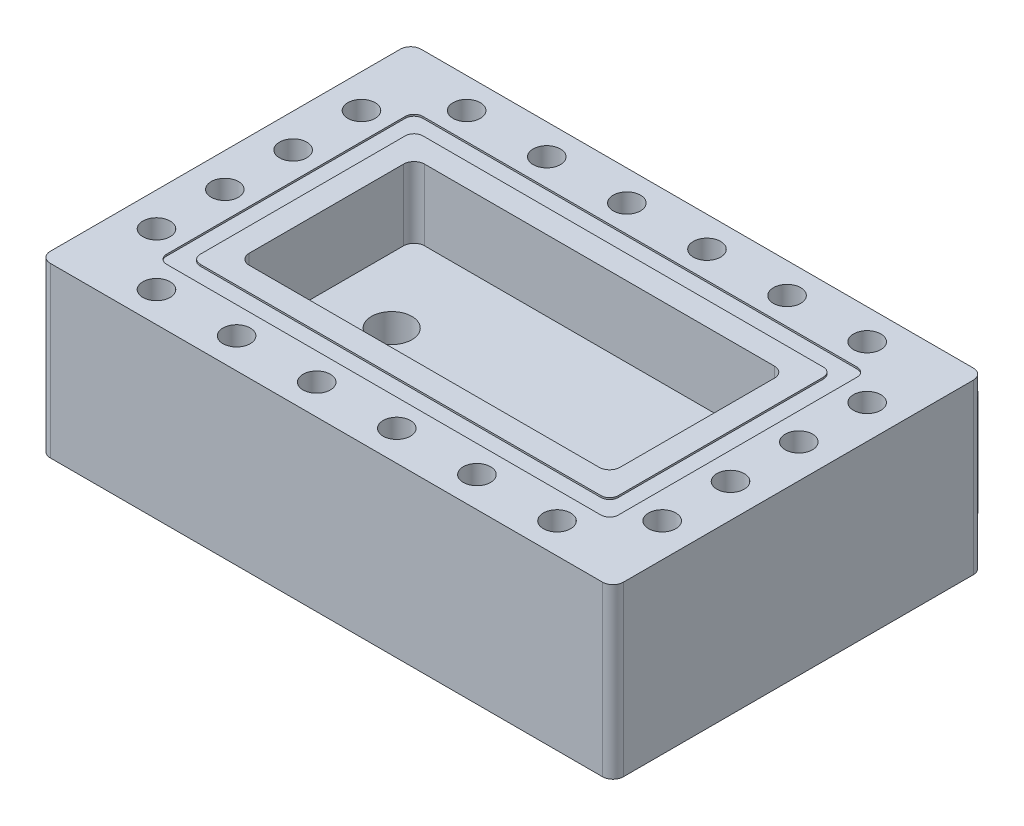
from build123d import *

# Parameters (mm, degrees)
SKETCH1_R           = 2
BOSS_EXTRUDE1_DEPTH = 25
SKETCH2_W           = 55
SKETCH2_H           = 26
CUT_EXTRUDE1_DEPTH  = 10.5
FILLET1_R           = 1.55
SKETCH3_W           = 67
SKETCH3_H           = 38
SKETCH3_W_2         = 62
SKETCH3_H_2         = 33
CUT_EXTRUDE2_DEPTH  = 0.25
FILLET2_R           = 1.3
SKETCH5_R           = 2.025
CUT_EXTRUDE4_DEPTH  = 110.886304879
SKETCH6_R           = 3
CUT_EXTRUDE5_DEPTH  = 108.982637493
CUT_EXTRUDE6_DEPTH  = 10


with BuildPart() as part:
    # Sketch1 → Boss-Extrude1 (new body)
    with BuildSketch(Plane(origin=(0, 0, 0), x_dir=(1, 0, 0), z_dir=(0, 1, 0))):
        with BuildLine():
            Line((80, 55), (85, 55))
            Line((85, 55), (85, 0))
            Line((85, 0), (0, 0))
            Line((0, 0), (0, 55))
            Line((0, 55), (60, 55))
            ThreePointArc((60, 55), (70, 65), (80, 55))
        make_face()
        with Locations(Location((70, 60, 0), (0, 0, 270))):
            Circle(SKETCH1_R, mode=Mode.SUBTRACT)
    extrude(amount=BOSS_EXTRUDE1_DEPTH)

    # Sketch2 → Cut-Extrude1 (cut)
    with BuildSketch(Plane(origin=(0, 25, 0), x_dir=(1, 0, 0), z_dir=(0, 1, 0))):
        with Locations((42.5, 27.5)):
            Rectangle(SKETCH2_W, SKETCH2_H)
    extrude(amount=-CUT_EXTRUDE1_DEPTH, mode=Mode.SUBTRACT)

    # Fillet1
    fillet1_edges = [part.edges().sort_by_distance(p)[0] for p in [
        (0, 12.5, -55),
        (60, 12.5, -55),
        (80, 12.5, -55),
        (85, 12.5, -55),
        (85, 12.5, 0),
        (0, 12.5, 0),
        (15, 19.75, -14.5),
        (15, 19.75, -40.5),
        (70, 19.75, -40.5),
        (70, 19.75, -14.5),
    ]]
    fillet(fillet1_edges, radius=FILLET1_R)

    # Sketch3 → Cut-Extrude2 (cut)
    with BuildSketch(Plane(origin=(0, 25, 0), x_dir=(1, 0, 0), z_dir=(0, 1, 0))):
        with Locations((42.5, 27.5)):
            Rectangle(SKETCH3_W, SKETCH3_H)
        with Locations((42.5, 27.5)):
            Rectangle(SKETCH3_W_2, SKETCH3_H_2, mode=Mode.SUBTRACT)
    extrude(amount=-CUT_EXTRUDE2_DEPTH, mode=Mode.SUBTRACT)

    # Fillet2
    fillet2_edges = [part.edges().sort_by_distance(p)[0] for p in [
        (9, 24.875, -8.5),
        (9, 24.875, -46.5),
        (76, 24.875, -46.5),
        (76, 24.875, -8.5),
        (11.5, 24.875, -44),
        (73.5, 24.875, -44),
        (73.5, 24.875, -11),
        (11.5, 24.875, -11),
    ]]
    fillet(fillet2_edges, radius=FILLET2_R)

    # Sketch5 → Cut-Extrude4 (cut, through all)
    with BuildSketch(Plane(origin=(0, 25, 0), x_dir=(1, 0, 0), z_dir=(0, 1, 0))):
        with Locations(Location((5, 42.7, 0), (0, 0, 270))):
            Circle(SKETCH5_R)
        with Locations(Location((5, 12.3, 0), (0, 0, 270))):
            Circle(SKETCH5_R)
        with Locations(Location((12.8, 4.5, 0), (0, 0, 270))):
            Circle(SKETCH5_R)
        with Locations(Location((72.2, 4.5, 0), (0, 0, 270))):
            Circle(SKETCH5_R)
        with Locations(Location((24.68, 4.5, 0), (0, 0, 270))):
            Circle(SKETCH5_R)
        with Locations(Location((36.56, 4.5, 0), (0, 0, 270))):
            Circle(SKETCH5_R)
        with Locations(Location((48.44, 4.5, 0), (0, 0, 270))):
            Circle(SKETCH5_R)
        with Locations(Location((60.32, 4.5, 0), (0, 0, 270))):
            Circle(SKETCH5_R)
        with Locations(Location((5, 32.566666667, 0), (0, 0, 270))):
            Circle(SKETCH5_R)
        with Locations(Location((5, 22.433333333, 0), (0, 0, 270))):
            Circle(SKETCH5_R)
        with Locations(Location((80, 42.7, 0), (0, 0, 270))):
            Circle(SKETCH5_R)
        with Locations(Location((80, 12.3, 0), (0, 0, 270))):
            Circle(SKETCH5_R)
        with Locations(Location((80, 22.433333333, 0), (0, 0, 270))):
            Circle(SKETCH5_R)
        with Locations(Location((80, 32.566666667, 0), (0, 0, 270))):
            Circle(SKETCH5_R)
        with Locations(Location((12.8, 50.5, 0), (0, 0, 270))):
            Circle(SKETCH5_R)
        with Locations(Location((24.68, 50.5, 0), (0, 0, 270))):
            Circle(SKETCH5_R)
        with Locations(Location((36.56, 50.5, 0), (0, 0, 270))):
            Circle(SKETCH5_R)
        with Locations(Location((48.44, 50.5, 0), (0, 0, 270))):
            Circle(SKETCH5_R)
        with Locations(Location((60.32, 50.5, 0), (0, 0, 270))):
            Circle(SKETCH5_R)
        with Locations(Location((72.2, 50.5, 0), (0, 0, 270))):
            Circle(SKETCH5_R)
    extrude(amount=-CUT_EXTRUDE4_DEPTH, mode=Mode.SUBTRACT)

    # Sketch6 → Cut-Extrude5 (cut, through all)
    with BuildSketch(Plane(origin=(0, 14.5, 0), x_dir=(1, 0, 0), z_dir=(0, 1, 0))):
        with Locations(Location((24.68, 27.5, 0), (0, 0, 270))):
            Circle(SKETCH6_R)
    extrude(amount=-CUT_EXTRUDE5_DEPTH, mode=Mode.SUBTRACT)

    # Sketch7 → Cut-Extrude6 (cut)
    with BuildSketch(Plane(origin=(0, 25, 0), x_dir=(1, 0, 0), z_dir=(0, 1, 0))):
        with BuildLine():
            Line((58.554476858, 55), (81.445523142, 55))
            ThreePointArc((81.445523142, 55), (80.425698015, 55.382756791), (79.909543846, 56.341991342))
            ThreePointArc((79.909543846, 56.341991342), (70, 65), (60.090456154, 56.341991342))
            ThreePointArc((60.090456154, 56.341991342), (59.574301985, 55.382756791), (58.554476858, 55))
        make_face()
    extrude(amount=-CUT_EXTRUDE6_DEPTH, mode=Mode.SUBTRACT)


solid = part.part
